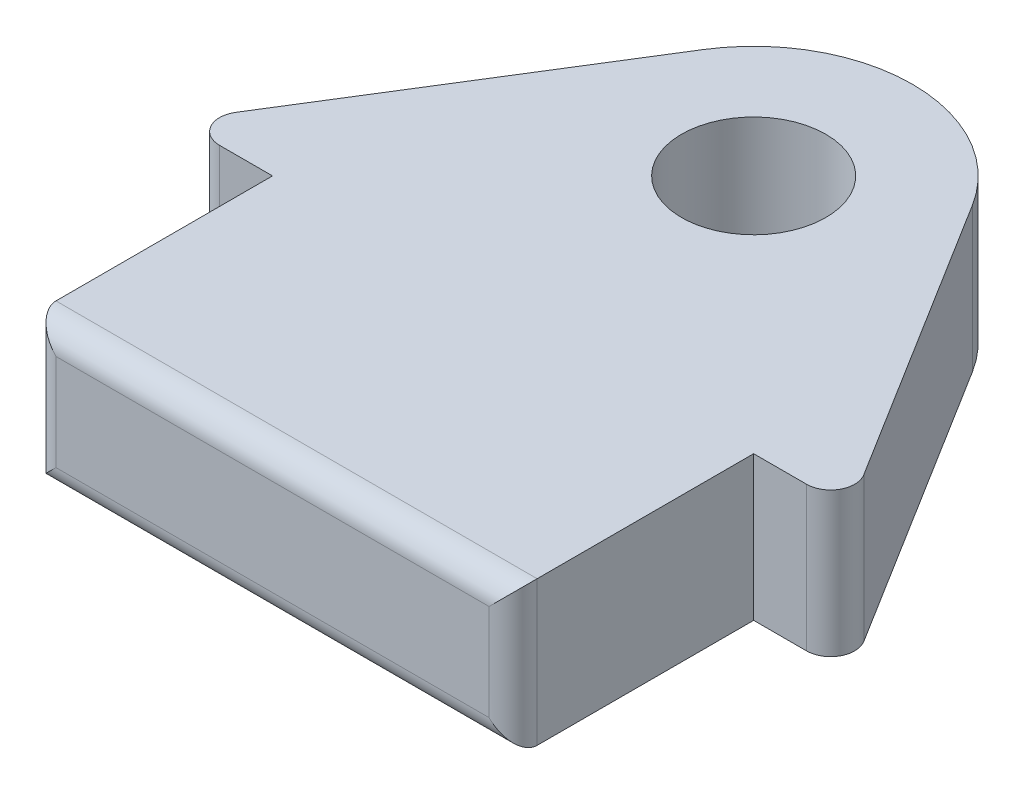
from build123d import *

# Parameters (mm, degrees)
SKETCH1_R           = 1.905
BOSS_EXTRUDE1_DEPTH = 3.81
FILLET1_R           = 0.635


with BuildPart() as part:
    # Sketch1 → Boss-Extrude1 (new body)
    with BuildSketch(Plane(origin=(0, 0, 0), x_dir=(1, 0, 0), z_dir=(0, 1, 0))):
        with BuildLine():
            Line((-8.89, -6.35), (-6.35, -6.35))
            Line((-6.35, -6.35), (-6.35, -12.7))
            Line((-6.35, -12.7), (6.35, -12.7))
            Line((6.35, -12.7), (6.35, -6.35))
            Line((6.35, -6.35), (8.89, -6.35))
            Line((8.89, -6.35), (3.557870234, 2.214958328))
            ThreePointArc((3.557870234, 2.214958328), (0, 4.191), (-3.557870234, 2.214958328))
            Line((-3.557870234, 2.214958328), (-8.89, -6.35))
        make_face()
        with Locations(Location((0, 0, 0), (0, 0, 90))):
            Circle(SKETCH1_R, mode=Mode.SUBTRACT)
    extrude(amount=BOSS_EXTRUDE1_DEPTH)

    # Fillet1
    fillet1_edges = [part.edges().sort_by_distance(p)[0] for p in [
        (0, 0, 12.7),
        (8.89, 1.905, 6.35),
        (6.35, 1.905, 12.7),
        (-6.35, 1.905, 12.7),
        (-8.89, 1.905, 6.35),
        (0, 3.81, 12.7),
    ]]
    fillet(fillet1_edges, radius=FILLET1_R)


solid = part.part
